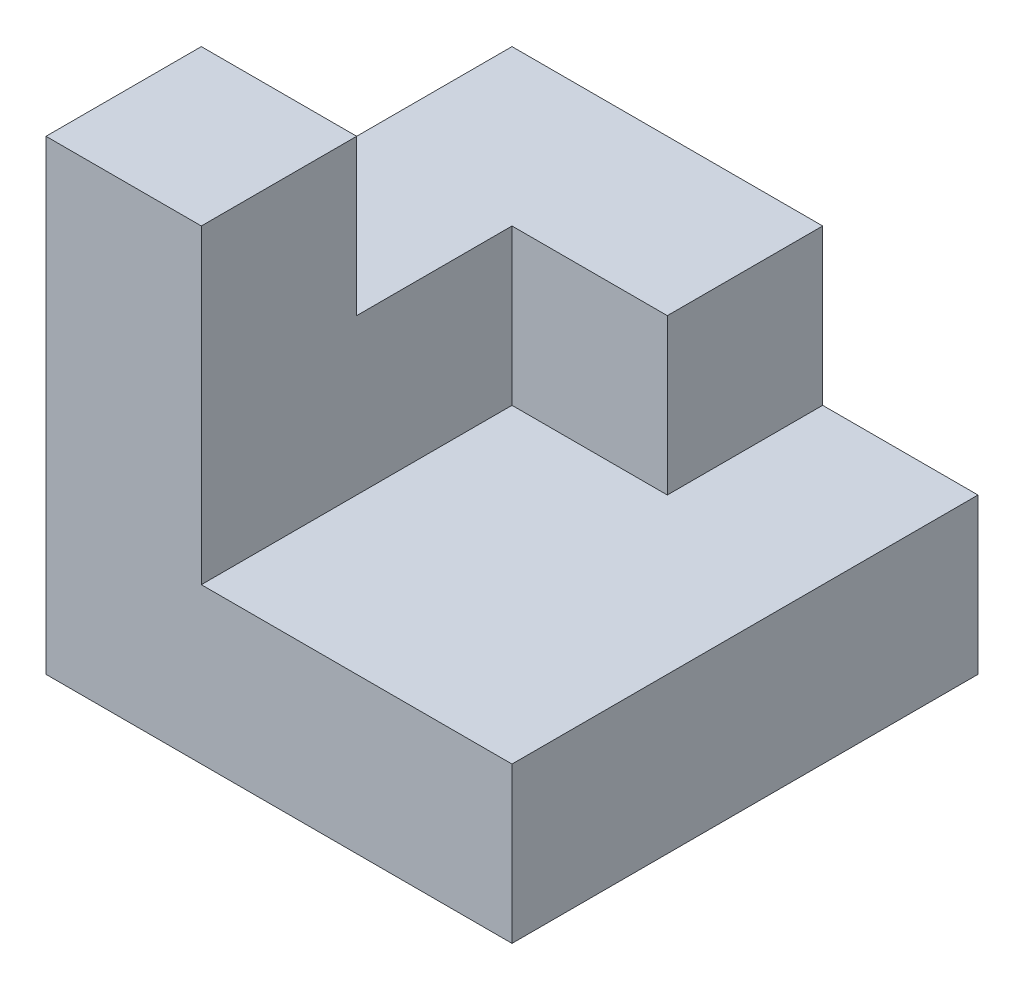
from build123d import *

# Parameters (mm, degrees)
CROQUIS1_W              = 60
CROQUIS1_H              = 60
SALIENTE_EXTRUIR1_DEPTH = 20
SALIENTE_EXTRUIR2_DEPTH = 20
CROQUIS3_W              = 20
CROQUIS3_H              = 20
SALIENTE_EXTRUIR3_DEPTH = 20


with BuildPart() as part:
    # Croquis1 → Saliente-Extruir1 (new body)
    with BuildSketch(Plane(origin=(0, 0, 0), x_dir=(1, 0, 0), z_dir=(0, 1, 0))):
        Rectangle(CROQUIS1_W, CROQUIS1_H)
    extrude(amount=SALIENTE_EXTRUIR1_DEPTH)

    # Croquis2 → Saliente-Extruir2 (add)
    with BuildSketch(Plane(origin=(0, 20, 0), x_dir=(1, 0, 0), z_dir=(0, 1, 0))):
        Polygon((-30, -30), (-10, -30), (-10, 10), (10, 10), (10, 30), (-30, 30), align=None)
    extrude(amount=SALIENTE_EXTRUIR2_DEPTH)

    # Croquis3 → Saliente-Extruir3 (add)
    with BuildSketch(Plane(origin=(0, 40, 0), x_dir=(1, 0, 0), z_dir=(0, 1, 0))):
        with Locations((-20, -20)):
            Rectangle(CROQUIS3_W, CROQUIS3_H)
    extrude(amount=SALIENTE_EXTRUIR3_DEPTH)


solid = part.part
